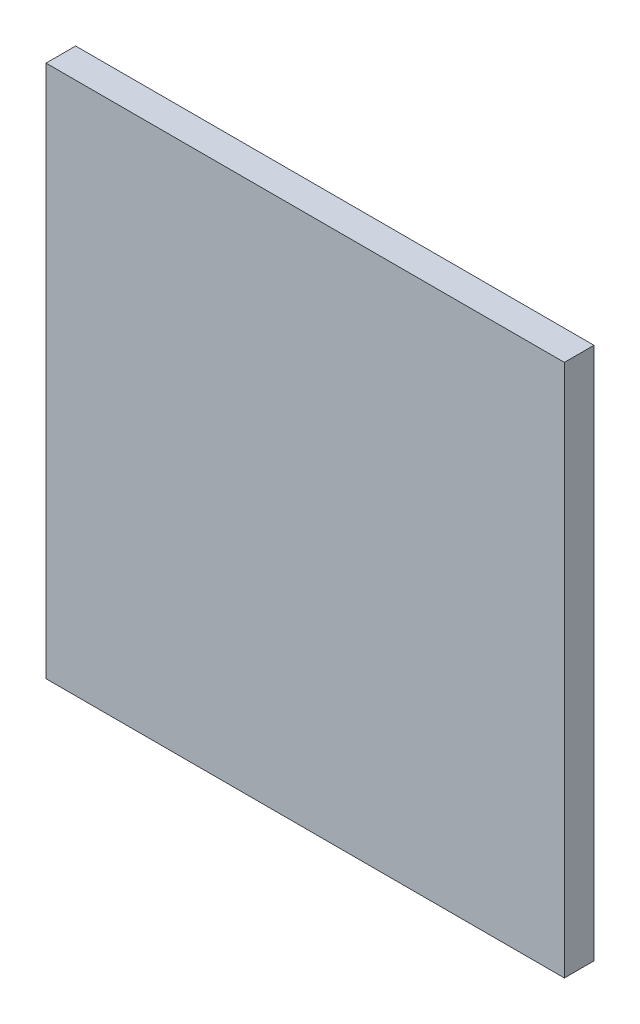
from build123d import *

# Parameters (mm, degrees)
SKETCH_1_W      = 35
SKETCH_1_H      = 36
EXTRUDE_1_DEPTH = 2


with BuildPart() as part:
    # 草图1 → 凸台-拉伸1 (new body)
    with BuildSketch(Plane.XY):
        Rectangle(SKETCH_1_W, SKETCH_1_H)
    extrude(amount=EXTRUDE_1_DEPTH)


solid = part.part
